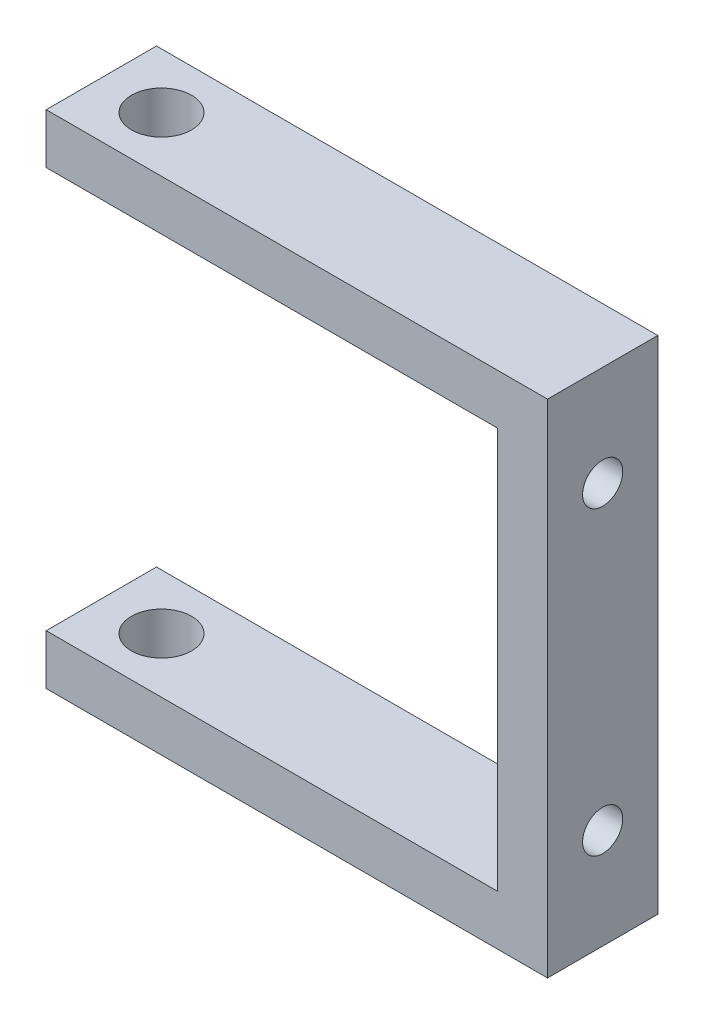
from build123d import *

# Parameters (mm, degrees)
BOSS_EXTRUDE1_DEPTH = 11
SKETCH2_R           = 3
CUT_EXTRUDE1_DEPTH  = 60
SKETCH4_R           = 2
CUT_EXTRUDE2_DEPTH  = 11


with BuildPart() as part:
    # Sketch1 → Boss-Extrude1 (new body)
    with BuildSketch(Plane.XY):
        Polygon((0, 50), (50, 50), (50, 0), (0, 0), (0, 5), (45, 5), (45, 45), (0, 45), align=None)
    extrude(amount=BOSS_EXTRUDE1_DEPTH)

    # Sketch2 → Cut-Extrude1 (cut)
    with BuildSketch(Plane(origin=(0, 50, 0), x_dir=(1, 0, 0), z_dir=(0, 1, 0))):
        with Locations(Location((6, -5.5, 0), (0, 0, 270))):
            Circle(SKETCH2_R)
    extrude(amount=-CUT_EXTRUDE1_DEPTH, mode=Mode.SUBTRACT)

    # Sketch4 → Cut-Extrude2 (cut)
    with BuildSketch(Plane.ZY.offset(-45)):
        with Locations((5.5, 40)):
            Circle(SKETCH4_R)
        with Locations((5.5, 10)):
            Circle(SKETCH4_R)
    extrude(amount=-CUT_EXTRUDE2_DEPTH, mode=Mode.SUBTRACT)


solid = part.part
